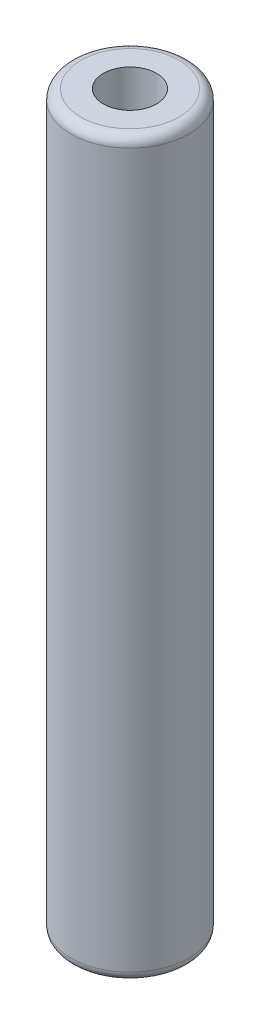
from build123d import *

# Parameters (mm, degrees)
BOSS_EXTRUDE1_DEPTH       = 18.65
BOSS_EXTRUDE1_DEPTH_BACK  = 18.65
SKETCH1_R                 = 3
F_6_32_TAPPED_HOLE1_D     = 2.7051
F_6_32_TAPPED_HOLE1_DEPTH = 12.5
F_6_32_TAPPED_HOLE1_TIP   = 0.81269403
F_6_32_TAPPED_HOLE2_D     = 2.7051
F_6_32_TAPPED_HOLE2_DEPTH = 12.5
F_6_32_TAPPED_HOLE2_TIP   = 0.81269403
FILLET1_R                 = 0.5


with BuildPart() as part:
    # Sketch1 → Boss-Extrude1 (new, two sides: drawn at the far end of the back side and taken through both)
    with BuildSketch(Plane(origin=(0, 0, 0), x_dir=(1, 0, 0), z_dir=(0, 1, 0)).offset(-BOSS_EXTRUDE1_DEPTH_BACK)):
        Circle(SKETCH1_R)
    extrude(amount=BOSS_EXTRUDE1_DEPTH + BOSS_EXTRUDE1_DEPTH_BACK)

    # #6-32 Tapped Hole1
    with Locations(Plane(origin=(0, 18.65, 0), x_dir=(1, 0, 0), z_dir=(0, 1, 0))):
        with Locations((0, 0)):
            Hole(F_6_32_TAPPED_HOLE1_D / 2, depth=F_6_32_TAPPED_HOLE1_DEPTH)
            with Locations((0, 0, -(F_6_32_TAPPED_HOLE1_DEPTH + F_6_32_TAPPED_HOLE1_TIP / 2))):  # 118° drill point
                Cone(0, F_6_32_TAPPED_HOLE1_D / 2, F_6_32_TAPPED_HOLE1_TIP, mode=Mode.SUBTRACT)

    # #6-32 Tapped Hole2
    with Locations(Plane(origin=(0, -18.65, 0), x_dir=(-1, 0, 0), z_dir=(0, -1, 0))):
        with Locations((0, 0)):
            Hole(F_6_32_TAPPED_HOLE2_D / 2, depth=F_6_32_TAPPED_HOLE2_DEPTH)
            with Locations((0, 0, -(F_6_32_TAPPED_HOLE2_DEPTH + F_6_32_TAPPED_HOLE2_TIP / 2))):  # 118° drill point
                Cone(0, F_6_32_TAPPED_HOLE2_D / 2, F_6_32_TAPPED_HOLE2_TIP, mode=Mode.SUBTRACT)

    # Fillet1
    fillet1_edges = [part.edges().sort_by_distance(p)[0] for p in [
        (-3, -18.65, 0),
        (-3, 18.65, 0),
    ]]
    fillet(fillet1_edges, radius=FILLET1_R)


solid = part.part
